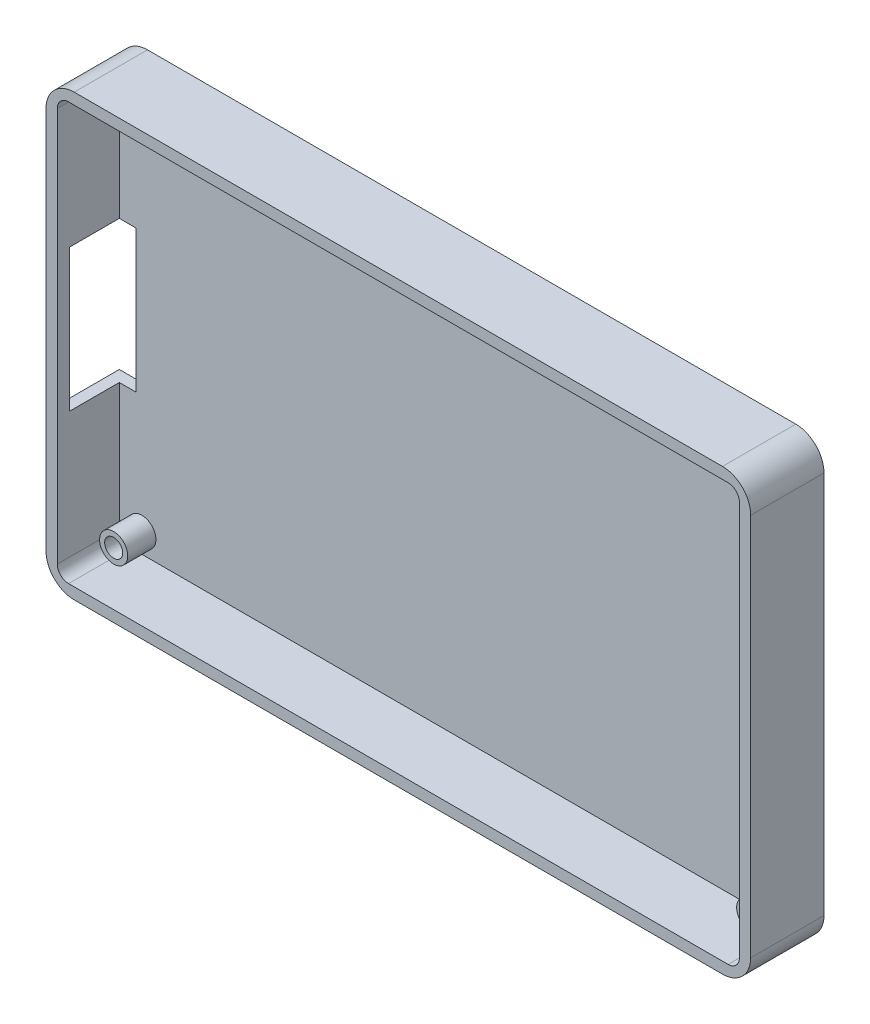
from build123d import *

# Parameters (mm, degrees)
SKETCH_1_W          = 125
SKETCH_1_H          = 78
SKETCH_1_R          = 3.6
SKETCH_1_R_2        = 1.6
SKETCH_1_W_2        = 120
SKETCH_1_H_2        = 74
EXTRUDE_1_DEPTH     = 13
SHELL_1_T           = -2
SKETCH_3_R          = 2.5
SKETCH_3_R_2        = 1.6
EXTRUDE_2_DEPTH     = 5
CUT_EXTRUDE_1_DEPTH = 5
FILLET_1_R          = 5
FILLET_2_R          = 2


with BuildPart() as part:
    # 草图1 → 凸台-拉伸1 (new body)
    # profile 1 of 6: a face of its own
    with BuildSketch(Plane.XY):
        Rectangle(SKETCH_1_W, SKETCH_1_H)
        with Locations((-57, -33.5)):
            Circle(SKETCH_1_R, mode=Mode.SUBTRACT)
        with Locations((-57, 33.5)):
            Circle(SKETCH_1_R, mode=Mode.SUBTRACT)
        with Locations((57, -33.5)):
            Circle(SKETCH_1_R, mode=Mode.SUBTRACT)
        with Locations((57, 33.5)):
            Circle(SKETCH_1_R, mode=Mode.SUBTRACT)
    # profile 2 of 6: a face of its own
    with BuildSketch(Plane.XY):
        with Locations((57, 33.5)):
            Circle(SKETCH_1_R)
        with Locations((57, 33.5)):
            Circle(SKETCH_1_R_2, mode=Mode.SUBTRACT)
    # profile 3 of 6: a face of its own
    with BuildSketch(Plane.XY):
        with Locations((-57, -33.5)):
            Circle(SKETCH_1_R)
        with Locations((-57, -33.5)):
            Circle(SKETCH_1_R_2, mode=Mode.SUBTRACT)
    # profile 4 of 6: a face of its own
    with BuildSketch(Plane.XY):
        with Locations((57, -33.5)):
            Circle(SKETCH_1_R)
        with Locations((57, -33.5)):
            Circle(SKETCH_1_R_2, mode=Mode.SUBTRACT)
    # profile 5 of 6: a face of its own
    with BuildSketch(Plane.XY):
        with Locations((-57, 33.5)):
            Circle(SKETCH_1_R)
        with Locations((-57, 33.5)):
            Circle(SKETCH_1_R_2, mode=Mode.SUBTRACT)
    # profile 6 of 6: a face of its own
    with BuildSketch(Plane.XY):
        Rectangle(SKETCH_1_W_2, SKETCH_1_H_2)
    extrude(amount=EXTRUDE_1_DEPTH)

    # 抽壳1
    shell_1_openings = [part.faces().sort_by_distance(p)[0] for p in [
        (0, 0, 13),
    ]]
    offset(amount=SHELL_1_T, openings=shell_1_openings, kind=Kind.INTERSECTION)

    # 草图3 → 凸台-拉伸2 (add)
    # profile 1 of 4: a face of its own
    with BuildSketch(Plane.XY.offset(2)):
        with Locations((-56.5, 33.5)):
            Circle(SKETCH_3_R)
        with Locations((-56.5, 33.5)):
            Circle(SKETCH_3_R_2, mode=Mode.SUBTRACT)
    # profile 2 of 4: a face of its own
    with BuildSketch(Plane.XY.offset(2)):
        with Locations(Location((56.5, 33.5, 0), (0, 0, 180))):
            Circle(SKETCH_3_R)
        with Locations(Location((56.5, 33.5, 0), (0, 0, 180))):
            Circle(SKETCH_3_R_2, mode=Mode.SUBTRACT)
    # profile 3 of 4: a face of its own
    with BuildSketch(Plane.XY.offset(2)):
        with Locations((56.5, -33.5)):
            Circle(SKETCH_3_R)
        with Locations((56.5, -33.5)):
            Circle(SKETCH_3_R_2, mode=Mode.SUBTRACT)
    # profile 4 of 4: a face of its own
    with BuildSketch(Plane.XY.offset(2)):
        with Locations(Location((-56.5, -33.5, 0), (0, 0, 180))):
            Circle(SKETCH_3_R)
        with Locations(Location((-56.5, -33.5, 0), (0, 0, 180))):
            Circle(SKETCH_3_R_2, mode=Mode.SUBTRACT)
    extrude(amount=EXTRUDE_2_DEPTH)

    # 草图5 → 切除-拉伸1 (cut)
    with BuildSketch(Plane.ZY.offset(62.5)):
        Polygon((2.138422059, 12.60316827), (10.861577941, 12.60316827), (10.861577941, -12.60316827), (2.138422059, -12.60316827), (0, -12.60316827), (0, 12.60316827), align=None)
    extrude(amount=-CUT_EXTRUDE_1_DEPTH, mode=Mode.SUBTRACT)

    # 圆角1
    fillet_1_edges = [part.edges().sort_by_distance(p)[0] for p in [
        (62.5, -39, 6.5),
        (-62.5, -39, 6.5),
        (-62.5, 39, 6.5),
        (62.5, 39, 6.5),
    ]]
    fillet(fillet_1_edges, radius=FILLET_1_R)

    # 圆角2
    fillet_2_edges = [part.edges().sort_by_distance(p)[0] for p in [
        (-60.5, 37, 7.5),
        (60.5, 37, 7.5),
        (60.5, -37, 7.5),
        (-60.5, -37, 7.5),
    ]]
    fillet(fillet_2_edges, radius=FILLET_2_R)


solid = part.part
